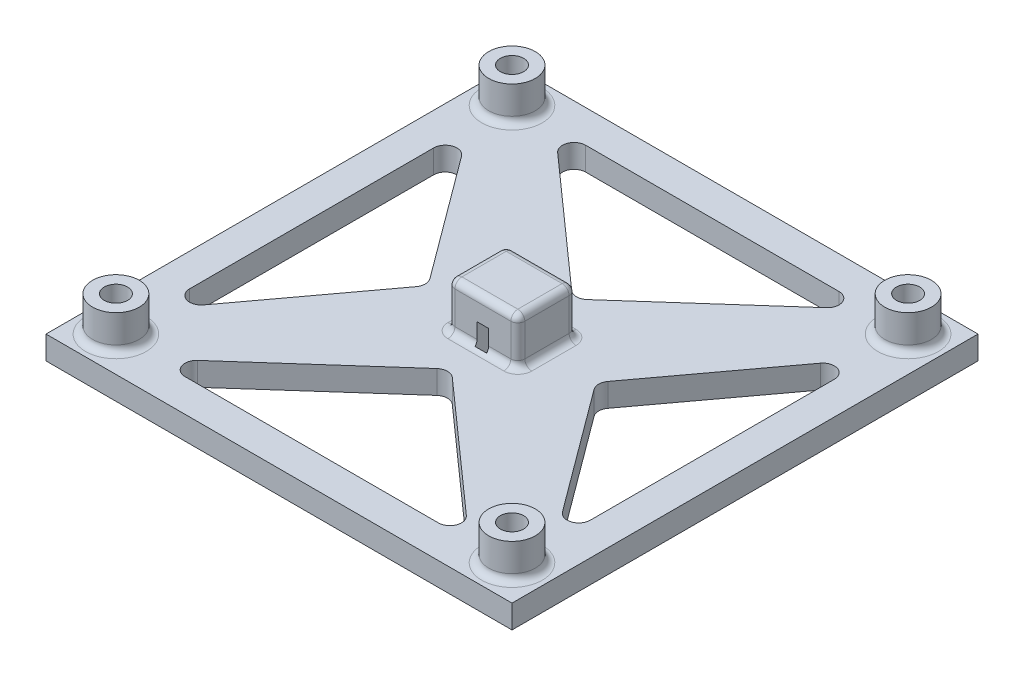
from build123d import *

# Parameters (mm, degrees)
SKETCH_1_W          = 200
SKETCH_1_H          = 200
SKETCH_1_R          = 5
EXTRUDE_1_DEPTH     = 7
SKETCH_2_R          = 10
SKETCH_2_R_2        = 5
EXTRUDE_2_DEPTH     = 15
SKETCH_3_W          = 200
SKETCH_3_H          = 200
EXTRUDE_3_DEPTH     = 3
EXTRUDE_4_DEPTH     = 12.5
FILLET_1_R          = 3
CUT_EXTRUDE_1_DEPTH = 2.5
CUT_EXTRUDE_2_DEPTH = 143.828568571
FILLET_2_R          = 5


with BuildPart() as part:
    # 草圖1 → 填料-伸長1 (new body)
    with BuildSketch(Plane(origin=(0, 0, 0), x_dir=(1, 0, 0), z_dir=(0, 1, 0))):
        Rectangle(SKETCH_1_W, SKETCH_1_H)
        with Locations(Location((85, 85, 0), (0, 0, 270))):
            Circle(SKETCH_1_R, mode=Mode.SUBTRACT)
        with Locations(Location((-85, 85, 0), (0, 0, 90))):
            Circle(SKETCH_1_R, mode=Mode.SUBTRACT)
        with Locations(Location((85, -85, 0), (0, 0, 90))):
            Circle(SKETCH_1_R, mode=Mode.SUBTRACT)
        with Locations(Location((-85, -85, 0), (0, 0, 270))):
            Circle(SKETCH_1_R, mode=Mode.SUBTRACT)
    extrude(amount=EXTRUDE_1_DEPTH)

    # 草圖2 → 填料-伸長2 (add)
    # profile 1 of 4: a face of its own
    with BuildSketch(Plane(origin=(0, 7, 0), x_dir=(1, 0, 0), z_dir=(0, 1, 0))):
        with Locations(Location((-85, 85, 0), (0, 0, 90))):
            Circle(SKETCH_2_R)
        with Locations(Location((-85, 85, 0), (0, 0, 90))):
            Circle(SKETCH_2_R_2, mode=Mode.SUBTRACT)
    # profile 2 of 4: a face of its own
    with BuildSketch(Plane(origin=(0, 7, 0), x_dir=(1, 0, 0), z_dir=(0, 1, 0))):
        with Locations(Location((85, 85, 0), (0, 0, 90))):
            Circle(SKETCH_2_R)
        with Locations(Location((85, 85, 0), (0, 0, 270))):
            Circle(SKETCH_2_R_2, mode=Mode.SUBTRACT)
    # profile 3 of 4: a face of its own
    with BuildSketch(Plane(origin=(0, 7, 0), x_dir=(1, 0, 0), z_dir=(0, 1, 0))):
        with Locations(Location((85, -85, 0), (0, 0, 90))):
            Circle(SKETCH_2_R)
        with Locations(Location((85, -85, 0), (0, 0, 90))):
            Circle(SKETCH_2_R_2, mode=Mode.SUBTRACT)
    # profile 4 of 4: a face of its own
    with BuildSketch(Plane(origin=(0, 7, 0), x_dir=(1, 0, 0), z_dir=(0, 1, 0))):
        with Locations(Location((-85, -85, 0), (0, 0, 90))):
            Circle(SKETCH_2_R)
        with Locations(Location((-85, -85, 0), (0, 0, 270))):
            Circle(SKETCH_2_R_2, mode=Mode.SUBTRACT)
    extrude(amount=EXTRUDE_2_DEPTH)

    # 草圖3 → 填料-伸長3 (add)
    with BuildSketch(Plane.XZ):
        Rectangle(SKETCH_3_W, SKETCH_3_H)
    extrude(amount=EXTRUDE_3_DEPTH)

    # 草圖4 → 填料-伸長4 (add, symmetric)
    with BuildSketch(Plane.XY):
        Polygon((-15, 7), (-2.5, 7), (2.5, 7), (15, 7), (15, 27), (-15, 27), align=None)
    extrude(amount=EXTRUDE_4_DEPTH, both=True)

    # 圓角1
    fillet_1_edges = [part.edges().sort_by_distance(p)[0] for p in [
        (-85, 7, -75),
        (85, 7, -75),
        (85, 7, 95),
        (-85, 7, 95),
        (-15, 17, -12.5),
        (-15, 27, 0),
        (0, 7, -12.5),
        (-15, 7, 0),
        (15, 17, -12.5),
        (15, 7, 0),
        (0, 27, -12.5),
        (15, 27, 0),
        (-15, 17, 12.5),
        (0, 7, 12.5),
        (15, 17, 12.5),
        (0, 27, 12.5),
    ]]
    fillet(fillet_1_edges, radius=FILLET_1_R)

    # 草圖5 → 除料-伸長1 (cut, symmetric)
    with BuildSketch(Plane(origin=(0, 0, 0), x_dir=(0, 0, -1), z_dir=(1, 0, 0))):
        with BuildLine():
            Line((-16, 16.572089393), (-8, 16.572089393))
            ThreePointArc((-8, 16.572089393), (0, 8.572089393), (8, 16.572089393))
            Line((8, 16.572089393), (16, 16.572089393))
            ThreePointArc((16, 16.572089393), (0, 0.572089393), (-16, 16.572089393))
        make_face()
    extrude(amount=CUT_EXTRUDE_1_DEPTH, both=True, mode=Mode.SUBTRACT)

    # 草圖6 → 除料-伸長2 (cut, through all)
    with BuildSketch(Plane(origin=(0, 7, 0), x_dir=(1, 0, 0), z_dir=(0, 1, 0))):
        Polygon((-67.5, 85.991963893), (0, 25.991963893), (67.5, 85.991963893), align=None)
        Polygon((85.991963893, -67.5), (85.991963893, 67.5), (35.991963893, 0), align=None)
        Polygon((-67.5, -85.991963893), (67.5, -85.991963893), (0, -25.991963893), align=None)
        Polygon((-85.991963893, 67.5), (-85.991963893, -67.5), (-35.991963893, 0), align=None)
    extrude(amount=-CUT_EXTRUDE_2_DEPTH, mode=Mode.SUBTRACT)

    # 圓角2
    fillet_2_edges = [part.edges().sort_by_distance(p)[0] for p in [
        (0, 2, 25.991963893),
        (67.5, 2, 85.991963893),
        (-67.5, 2, 85.991963893),
        (35.991963893, 2, 0),
        (85.991963893, 2, -67.5),
        (85.991963893, 2, 67.5),
        (-35.991963893, 2, 0),
        (-85.991963893, 2, 67.5),
        (-85.991963893, 2, -67.5),
        (-67.5, 2, -85.991963893),
        (67.5, 2, -85.991963893),
        (0, 2, -25.991963893),
    ]]
    fillet(fillet_2_edges, radius=FILLET_2_R)


solid = part.part
